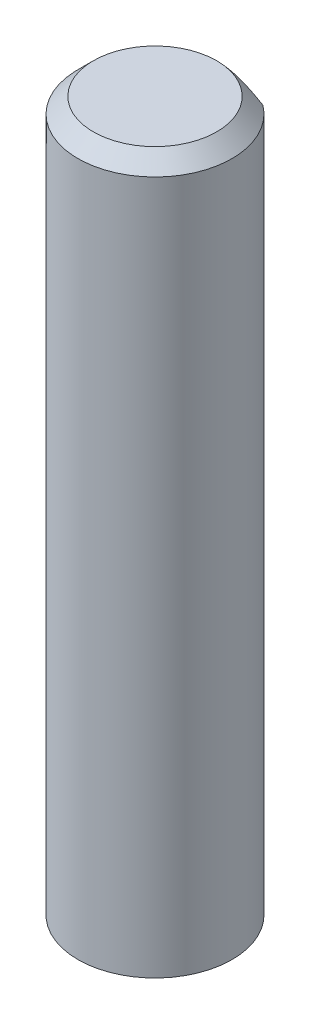
from build123d import *

# Parameters (mm, degrees)
SKETCH1_R               = 2.5
BOSS_EXTRUDE1_DEPTH     = 23
CHAMFER1_SIZE           = 0.5
CUT_EXTRUDE1_DEPTH      = 24.270152556
CUT_EXTRUDE1_DEPTH_BACK = 24.270152556
SKETCH2_W               = 0.5
SKETCH2_H               = 18


with BuildPart() as part:
    # Sketch1 → Boss-Extrude1 (new body)
    with BuildSketch(Plane(origin=(0, 0, 0), x_dir=(1, 0, 0), z_dir=(0, 1, 0))):
        with Locations(Location((0, 0, 0), (0, 0, 270))):
            Circle(SKETCH1_R)
    extrude(amount=BOSS_EXTRUDE1_DEPTH)

    # Chamfer1
    chamfer1_edges = [part.edges().sort_by_distance(p)[0] for p in [
        (0, 23, -2.5),
    ]]
    chamfer(chamfer1_edges, length=CHAMFER1_SIZE)

    # Sketch2 → Cut-Extrude1 (cut, two sides: drawn at the far end of the back side and taken through both)
    with BuildSketch(Plane(origin=(0, 0, 0), x_dir=(0, 0, -1), z_dir=(1, 0, 0)).offset(-CUT_EXTRUDE1_DEPTH_BACK)):
        with Locations((2.25, 14)):
            Rectangle(SKETCH2_W, SKETCH2_H)
    extrude(amount=CUT_EXTRUDE1_DEPTH + CUT_EXTRUDE1_DEPTH_BACK, mode=Mode.SUBTRACT)


solid = part.part
